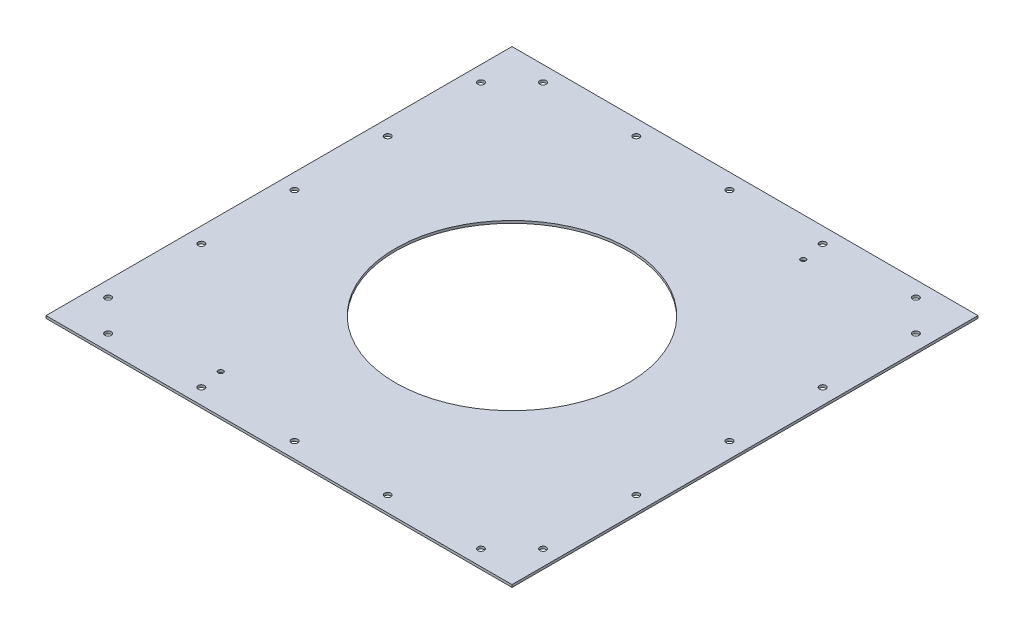
from build123d import *

# Parameters (mm, degrees)
BOSS_EXTRUDE1_DEPTH      = 1.5875
BOSS_EXTRUDE1_DEPTH_BACK = 1.5875
SKETCH1_W                = 600
SKETCH1_H                = 600
SKETCH1_R                = 3.25
SKETCH1_R_2              = 150
SKETCH3_R                = 4.1
CUT_EXTRUDE2_DEPTH       = 425.267038734
CIRPATTERN1_COUNT        = 4


with BuildPart() as part:
    # Sketch1 → Boss-Extrude1 (new, two sides: drawn at the far end of the back side and taken through both)
    with BuildSketch(Plane(origin=(0, 0, 0), x_dir=(1, 0, 0), z_dir=(0, 1, 0)).offset(-BOSS_EXTRUDE1_DEPTH_BACK)):
        Rectangle(SKETCH1_W, SKETCH1_H)
        with Locations((125, 250)):
            Circle(SKETCH1_R, mode=Mode.SUBTRACT)
        with Locations((-125, -250)):
            Circle(SKETCH1_R, mode=Mode.SUBTRACT)
        Circle(SKETCH1_R_2, mode=Mode.SUBTRACT)
    extrude(amount=BOSS_EXTRUDE1_DEPTH + BOSS_EXTRUDE1_DEPTH_BACK)

    # Sketch3 → Cut-Extrude2 (cut, symmetric)
    with BuildSketch(Plane(origin=(0, 0, 0), x_dir=(1, 0, 0), z_dir=(0, 1, 0))):
        with Locations((0, 280)):
            Circle(SKETCH3_R)
        with Locations((-120, 280)):
            Circle(SKETCH3_R)
        with Locations((-240, 280)):
            Circle(SKETCH3_R)
        with Locations((240, 280)):
            Circle(SKETCH3_R)
        with Locations((120, 280)):
            Circle(SKETCH3_R)
    cut_extrude2 = extrude(amount=CUT_EXTRUDE2_DEPTH, both=True, mode=Mode.SUBTRACT)

    # CirPattern1: Cut-Extrude2 ×4 about axis
    cirpattern1_axis = Axis((0, 1.74625, 0), (0, -1, 0))
    for i in range(1, CIRPATTERN1_COUNT):
        add(cut_extrude2.rotate(cirpattern1_axis, i * 360 / CIRPATTERN1_COUNT), mode=Mode.SUBTRACT)


solid = part.part
